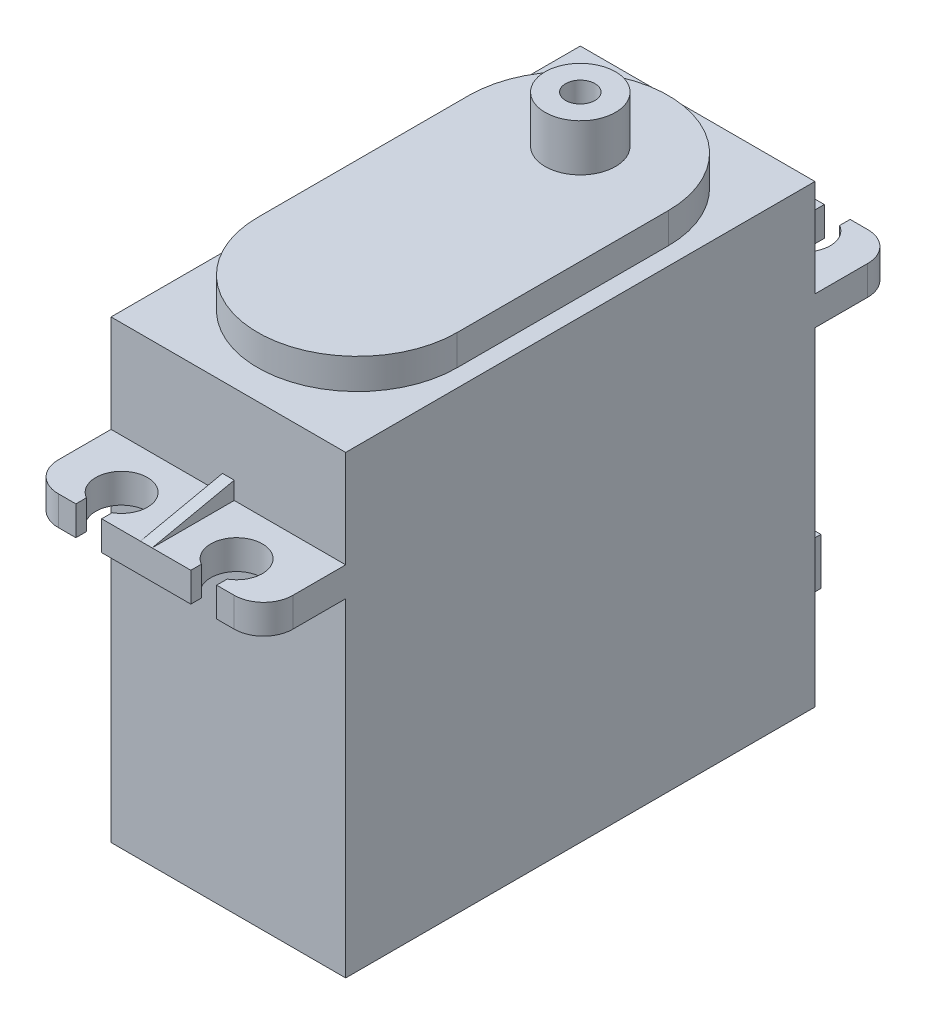
from build123d import *

# Parameters (mm, degrees)
SKETCH_1_W      = 20
SKETCH_1_H      = 40
EXTRUDE_1_DEPTH = 38.8
EXTRUDE_START   = 28
EXTRUDE_2_DEPTH = 2.5
EXTRUDE_3_DEPTH = 0.5
EXTRUDE_START_2 = 38.8
EXTRUDE_4_DEPTH = 2.6
EXTRUDE_START_3 = 41.4
SKETCH_5_R      = 3
SKETCH_5_R_2    = 1.25
EXTRUDE_5_DEPTH = 4
EXTRUDE_START_4 = -20
SKETCH_6_W      = 7
SKETCH_6_H      = 4
EXTRUDE_6_DEPTH = 7


with BuildPart() as part:
    # 草图1 → 凸台-拉伸1 (new body)
    with BuildSketch(Plane(origin=(0, 0, 0), x_dir=(1, 0, 0), z_dir=(0, 1, 0))):
        Rectangle(SKETCH_1_W, SKETCH_1_H)
    extrude(amount=EXTRUDE_1_DEPTH)

    # 草图2 → 凸台-拉伸2 (add)
    with BuildSketch(Plane(origin=(0, 0, 0), x_dir=(1, 0, 0), z_dir=(0, 1, 0)).offset(EXTRUDE_START)):
        with BuildLine():
            Line((-7.5, -27), (-6, -27))
            Line((-6, -27), (-6, -26.105255888))
            ThreePointArc((-6, -26.105255888), (-4.9, -22), (-3.8, -26.105255888))
            Line((-3.8, -26.105255888), (-3.8, -27))
            Line((-3.8, -27), (3.8, -27))
            Line((3.8, -27), (3.8, -26.105255888))
            ThreePointArc((3.8, -26.105255888), (4.9, -22), (6, -26.105255888))
            Line((6, -26.105255888), (6, -27))
            Line((6, -27), (7.5, -27))
            ThreePointArc((7.5, -27), (9.267766953, -26.267766953), (10, -24.5))
            Line((10, -24.5), (10, 24.5))
            ThreePointArc((10, 24.5), (9.267766953, 26.267766953), (7.5, 27))
            Line((7.5, 27), (6, 27))
            Line((6, 27), (6, 26.105255888))
            ThreePointArc((6, 26.105255888), (4.9, 22), (3.8, 26.105255888))
            Line((3.8, 26.105255888), (3.8, 27))
            Line((3.8, 27), (-3.8, 27))
            Line((-3.8, 27), (-3.8, 26.105255888))
            ThreePointArc((-3.8, 26.105255888), (-4.9, 22), (-6, 26.105255888))
            Line((-6, 26.105255888), (-6, 27))
            Line((-6, 27), (-7.5, 27))
            ThreePointArc((-7.5, 27), (-9.267766953, 26.267766953), (-10, 24.5))
            Line((-10, 24.5), (-10, -24.5))
            ThreePointArc((-10, -24.5), (-9.267766953, -26.267766953), (-7.5, -27))
        make_face()
    extrude(amount=EXTRUDE_2_DEPTH)

    # 草图3 → 凸台-拉伸3 (add, symmetric)
    with BuildSketch(Plane(origin=(0, 0, 0), x_dir=(0, 0, -1), z_dir=(1, 0, 0))):
        Polygon((-20, 30.5), (-27, 30.5), (-20, 32), align=None)
        Polygon((20, 32), (20, 30.5), (27, 30.5), align=None)
    extrude(amount=EXTRUDE_3_DEPTH, both=True)

    # 草图4 → 凸台-拉伸4 (add)
    with BuildSketch(Plane(origin=(0, 0, 0), x_dir=(1, 0, 0), z_dir=(0, 1, 0)).offset(EXTRUDE_START_2)):
        with BuildLine():
            Line((8.5, -9), (8.5, 9))
            ThreePointArc((8.5, 9), (0, 17.5), (-8.5, 9))
            Line((-8.5, 9), (-8.5, -9))
            ThreePointArc((-8.5, -9), (0, -17.5), (8.5, -9))
        make_face()
    extrude(amount=EXTRUDE_4_DEPTH)


with BuildPart() as body_2:
    # 草图5 → 凸台-拉伸5 (new body)
    with BuildSketch(Plane(origin=(0, 0, 0), x_dir=(1, 0, 0), z_dir=(0, 1, 0)).offset(EXTRUDE_START_3)):
        with Locations(Location((0, 10, 0), (0, 0, 270))):
            Circle(SKETCH_5_R)
        with Locations(Location((0, 10, 0), (0, 0, 270))):
            Circle(SKETCH_5_R_2, mode=Mode.SUBTRACT)
    extrude(amount=EXTRUDE_5_DEPTH)


with BuildPart() as body_3:
    # 草图6 → 凸台-拉伸6 (new body)
    with BuildSketch(Plane.XY.offset(EXTRUDE_START_4)):
        with Locations((0, 4)):
            Rectangle(SKETCH_6_W, SKETCH_6_H)
    extrude(amount=-EXTRUDE_6_DEPTH)


solid = Compound([part.part, body_2.part, body_3.part])
